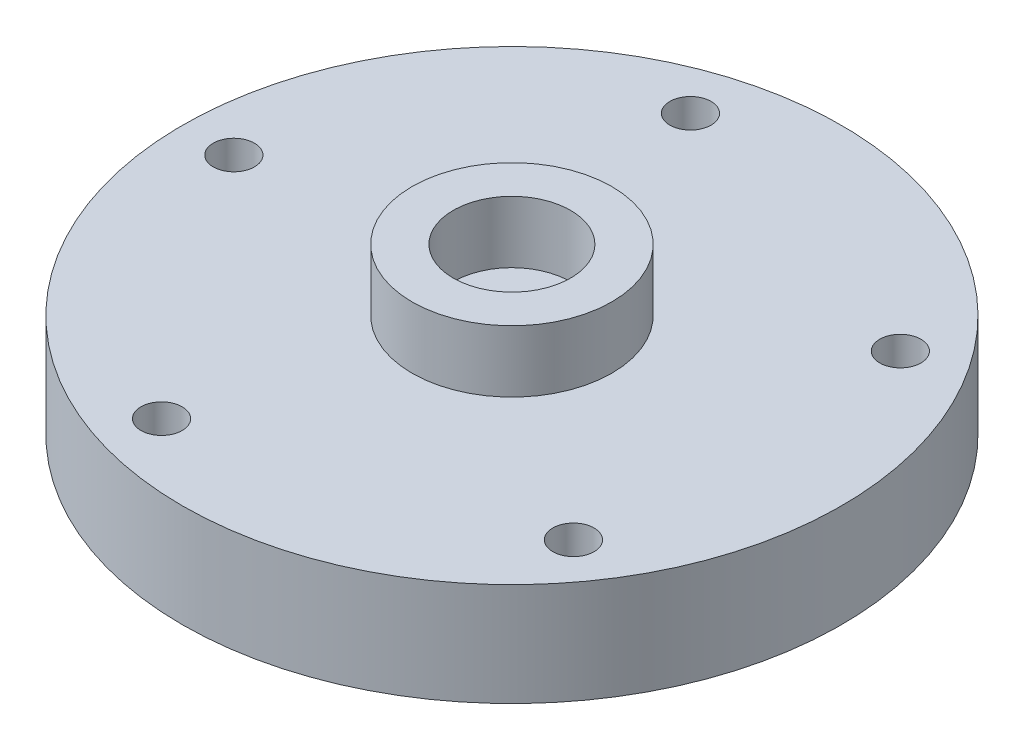
from build123d import *

# Parameters (mm, degrees)
BOSS_EXTRUDE1_DEPTH      = 2
BOSS_EXTRUDE1_DEPTH_BACK = 3
SKETCH1_R                = 16
SKETCH1_R_2              = 1
SKETCH2_R                = 4.85
SKETCH2_R_2              = 2.85
BOSS_EXTRUDE3_DEPTH      = 3
SKETCH5_R                = 2
CUT_EXTRUDE2_DEPTH       = 1


with BuildPart() as part:
    # Sketch1 → Boss-Extrude1 (new, two sides: drawn at the far end of the back side and taken through both)
    with BuildSketch(Plane(origin=(0, 0, 0), x_dir=(1, 0, 0), z_dir=(0, 1, 0)).offset(-BOSS_EXTRUDE1_DEPTH_BACK)):
        with Locations(Location((0, 0, 0), (0, 0, 270))):
            Circle(SKETCH1_R)
        with Locations(Location((0, 0, 0), (0, 0, 270))):
            Circle(SKETCH1_R_2, mode=Mode.SUBTRACT)
        with Locations(Location((-13.5, 0, 0), (0, 0, 270))):
            Circle(SKETCH1_R_2, mode=Mode.SUBTRACT)
        with Locations(Location((-4.171729424, 12.83926297, 0), (0, 0, 270))):
            Circle(SKETCH1_R_2, mode=Mode.SUBTRACT)
        with Locations(Location((10.921729424, 7.935100906, 0), (0, 0, 270))):
            Circle(SKETCH1_R_2, mode=Mode.SUBTRACT)
        with Locations(Location((10.921729424, -7.935100906, 0), (0, 0, 270))):
            Circle(SKETCH1_R_2, mode=Mode.SUBTRACT)
        with Locations(Location((-4.171729424, -12.83926297, 0), (0, 0, 270))):
            Circle(SKETCH1_R_2, mode=Mode.SUBTRACT)
    extrude(amount=BOSS_EXTRUDE1_DEPTH + BOSS_EXTRUDE1_DEPTH_BACK)

    # Sketch2 → Boss-Extrude3 (add)
    with BuildSketch(Plane(origin=(0, 2, 0), x_dir=(1, 0, 0), z_dir=(0, 1, 0))):
        with Locations(Location((0, 0, 0), (0, 0, 270))):
            Circle(SKETCH2_R)
        with Locations(Location((0, 0, 0), (0, 0, 270))):
            Circle(SKETCH2_R_2, mode=Mode.SUBTRACT)
    extrude(amount=BOSS_EXTRUDE3_DEPTH)

    # Sketch5 → Cut-Extrude2 (cut)
    with BuildSketch(Plane.XZ.offset(3)):
        with Locations(Location((0, 0, 0), (0, 0, 270))):
            Circle(SKETCH5_R)
    extrude(amount=-CUT_EXTRUDE2_DEPTH, mode=Mode.SUBTRACT)


solid = part.part
